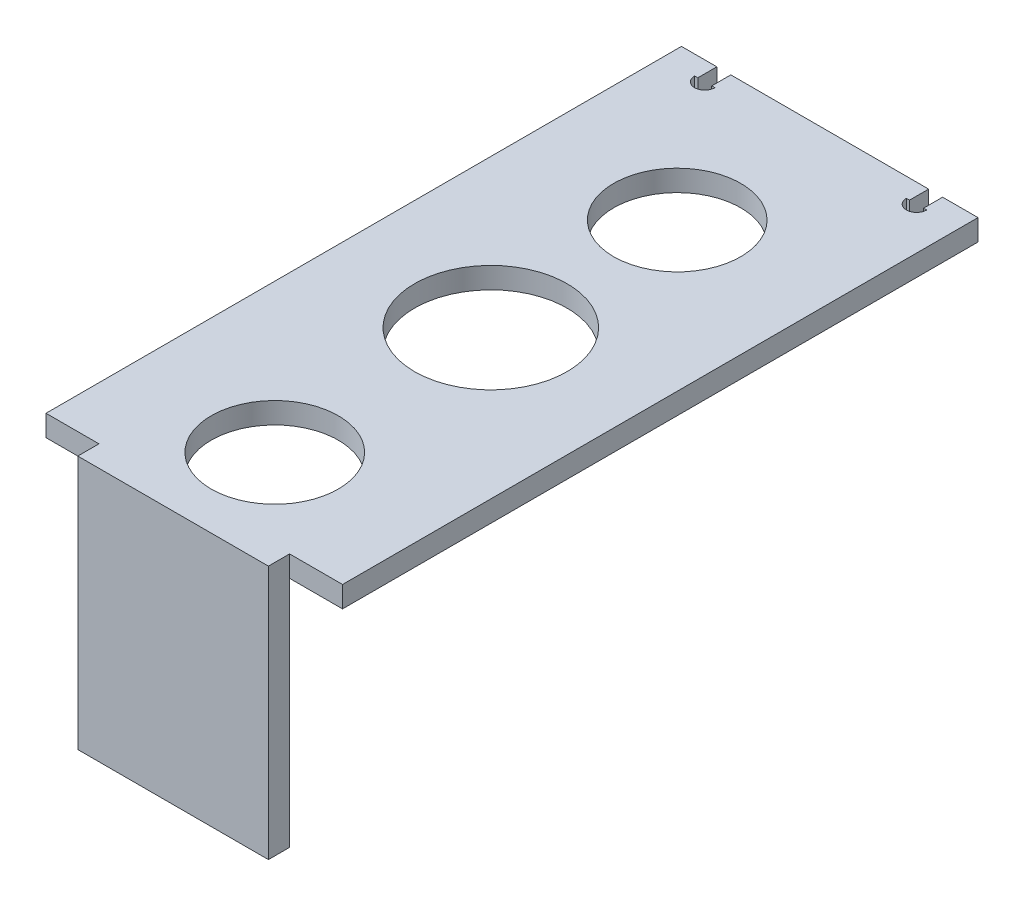
from build123d import *

# Parameters (mm, degrees)
BOSS_EXTRUDE1_DEPTH     = 2.5
SKETCH4_W               = 41.785
SKETCH4_H               = 150
CUT_EXTRUDE1_DEPTH      = 120
SKETCH5_W               = 5
SKETCH5_H               = 60
BOSS_EXTRUDE2_DEPTH     = 22.5
CUT_EXTRUDE2_DEPTH      = 106.948100502
CUT_EXTRUDE2_DEPTH_BACK = 106.948100502
SKETCH3_R               = 15
SKETCH3_R_2             = 18


with BuildPart() as part:
    # Sketch2 → Boss-Extrude1 (new, symmetric)
    with BuildSketch(Plane(origin=(0, 0, 0), x_dir=(1, 0, 0), z_dir=(0, 1, 0))):
        with BuildLine():
            Line((-26.65, 80), (-76.785, 80))
            Line((-76.785, 80), (-76.785, -70))
            Line((-76.785, -70), (76.785, -70))
            Line((76.785, -70), (76.785, 80))
            Line((76.785, 80), (26.65, 80))
            Line((26.65, 80), (26.65, 75.5))
            Line((26.65, 75.5), (27.4, 75.5))
            ThreePointArc((27.4, 75.5), (25, 73.1), (22.6, 75.5))
            Line((22.6, 75.5), (23.35, 75.5))
            Line((23.35, 75.5), (23.35, 80))
            Line((23.35, 80), (-23.35, 80))
            Line((-23.35, 80), (-23.35, 75.5))
            Line((-23.35, 75.5), (-22.6, 75.5))
            ThreePointArc((-22.6, 75.5), (-25, 73.1), (-27.4, 75.5))
            Line((-27.4, 75.5), (-26.65, 75.5))
            Line((-26.65, 75.5), (-26.65, 80))
        make_face()
    extrude(amount=BOSS_EXTRUDE1_DEPTH, both=True)

    # Sketch4 → Cut-Extrude1 (cut)
    with BuildSketch(Plane(origin=(0, 2.5, 0), x_dir=(1, 0, 0), z_dir=(0, 1, 0))):
        with Locations((-55.8925, 5)):
            Rectangle(SKETCH4_W, SKETCH4_H)
        with Locations((55.8925, 5)):
            Rectangle(SKETCH4_W, SKETCH4_H)
    extrude(amount=-CUT_EXTRUDE1_DEPTH, mode=Mode.SUBTRACT)

    # Sketch5 → Boss-Extrude2 (add, symmetric)
    with BuildSketch(Plane(origin=(0, 0, 0), x_dir=(0, 0, -1), z_dir=(1, 0, 0))):
        with Locations((-72.5, -27.5)):
            Rectangle(SKETCH5_W, SKETCH5_H)
    extrude(amount=BOSS_EXTRUDE2_DEPTH, both=True)

    # Sketch3 → Cut-Extrude2 (cut, two sides: drawn at the far end of the back side and taken through both)
    with BuildSketch(Plane(origin=(0, 2.5, 0), x_dir=(1, 0, 0), z_dir=(0, 1, 0)).offset(-CUT_EXTRUDE2_DEPTH_BACK)):
        with Locations(Location((0, 44, 0), (0, 0, 270))):
            Circle(SKETCH3_R)
        with Locations(Location((0, -51, 0), (0, 0, 270))):
            Circle(SKETCH3_R)
        with Locations(Location((0, 0, 0), (0, 0, 270))):
            Circle(SKETCH3_R_2)
    extrude(amount=CUT_EXTRUDE2_DEPTH + CUT_EXTRUDE2_DEPTH_BACK, mode=Mode.SUBTRACT)


solid = part.part
